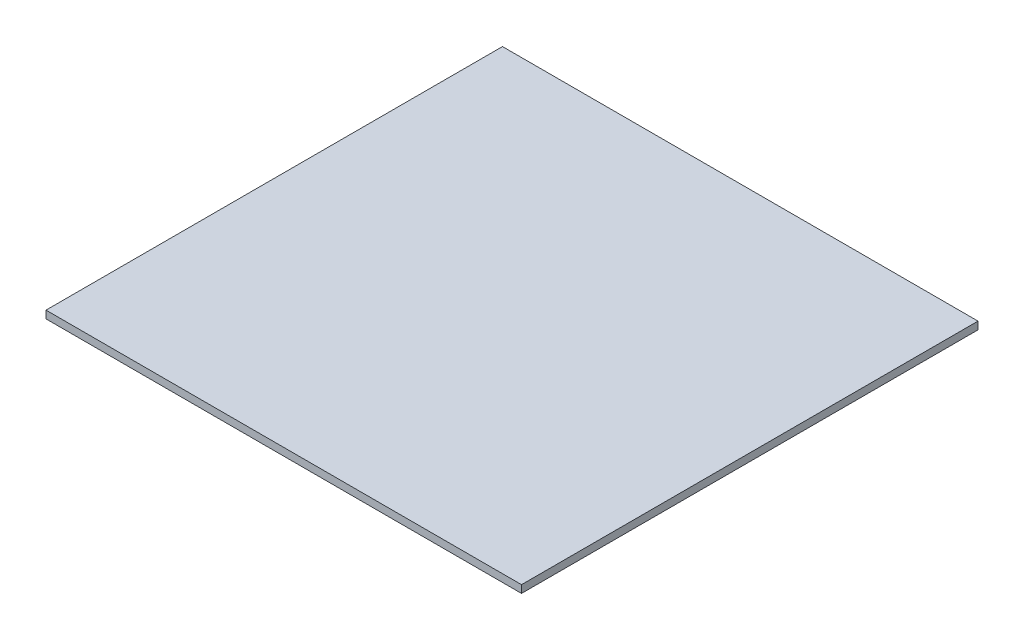
from build123d import *

# Parameters (mm, degrees)
SKETCH_1_W      = 125
SKETCH_1_H      = 120
EXTRUDE_1_DEPTH = 2


with BuildPart() as part:
    # 草圖1 → 填料-伸長1 (new body)
    with BuildSketch(Plane(origin=(0, 0, 0), x_dir=(1, 0, 0), z_dir=(0, 1, 0))):
        with Locations((6.25, 22.362132353)):
            Rectangle(SKETCH_1_W, SKETCH_1_H)
    extrude(amount=-EXTRUDE_1_DEPTH)


solid = part.part
